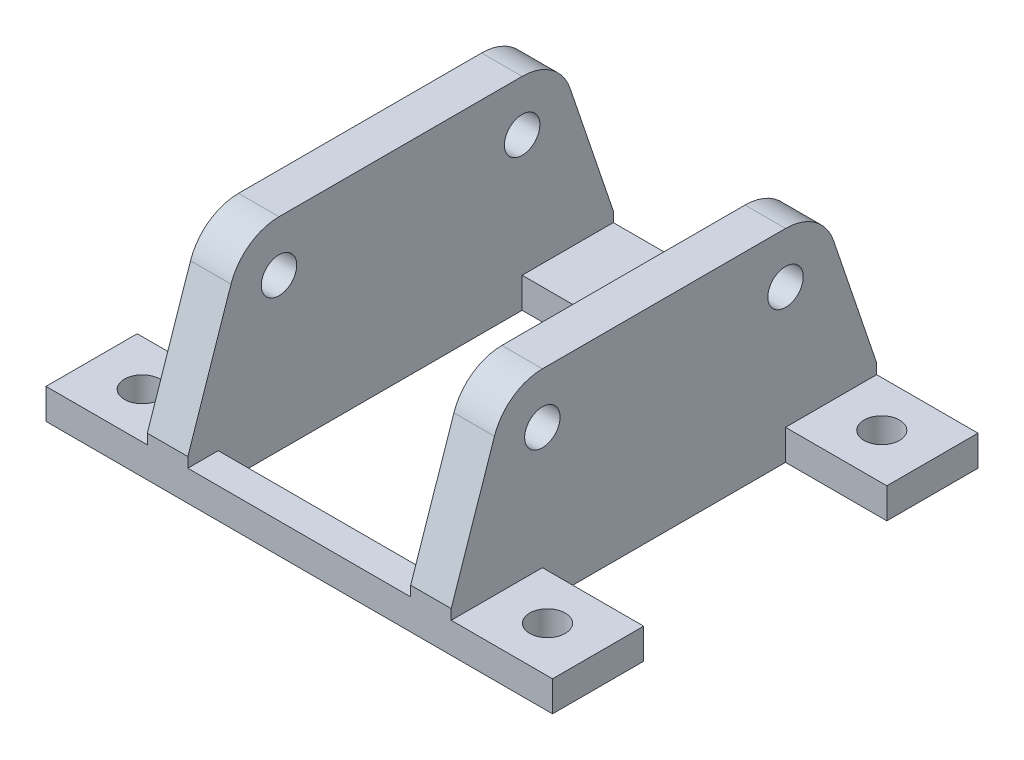
from build123d import *

# Parameters (mm, degrees)
ESBO_O1_W                  = 30
ESBO_O1_H                  = 50
ESBO_O1_W_2                = 22
ESBO_O1_H_2                = 42
RESSALTO_EXTRUS_O1_DEPTH   = 20
ESBO_O3_R                  = 1.75
CORTE_EXTRUS_O2_DEPTH      = 44.874821937
CORTE_EXTRUS_O3_DEPTH      = 44.874821937
CORTE_EXTRUS_O3_DEPTH_BACK = 44.874821937
ESBO_O6_R                  = 1.75
ESBO_O6_W                  = 50
ESBO_O6_H                  = 9
RESSALTO_EXTRUS_O2_DEPTH   = 3


with BuildPart() as part:
    # Esboço1 → Ressalto-extrusão1 (new body)
    with BuildSketch(Plane(origin=(0, 0, 0), x_dir=(1, 0, 0), z_dir=(0, 1, 0))):
        Rectangle(ESBO_O1_W, ESBO_O1_H)
        Rectangle(ESBO_O1_W_2, ESBO_O1_H_2, mode=Mode.SUBTRACT)
    extrude(amount=RESSALTO_EXTRUS_O1_DEPTH)

    # Esboço3 → Corte-extrusão2 (cut, through all)
    with BuildSketch(Plane(origin=(15, 0, 0), x_dir=(0, 0, -1), z_dir=(1, 0, 0))):
        with Locations((-12, 15)):
            Circle(ESBO_O3_R)
        with Locations((12, 15)):
            Circle(ESBO_O3_R)
    extrude(amount=-CORTE_EXTRUS_O2_DEPTH, mode=Mode.SUBTRACT)

    # Esboço5 → Corte-extrusão3 (cut, two sides: drawn at the far end of the back side and taken through both)
    with BuildSketch(Plane.ZY.offset(15).offset(-CORTE_EXTRUS_O3_DEPTH_BACK)):
        with BuildLine():
            Line((-16.736274298, 16.602406244), (-21, 4))
            Line((-21, 4), (-21, 0))
            Line((-21, 0), (-25, 0))
            Line((-25, 0), (-25, 4))
            Line((-25, 4), (-25, 20))
            Line((-25, 20), (-12, 20))
            ThreePointArc((-12, 20), (-14.914444096, 19.062759605), (-16.736274298, 16.602406244))
        make_face()
        with BuildLine():
            Line((25, 0), (25, 4))
            Line((25, 4), (25, 20))
            Line((25, 20), (12, 20))
            ThreePointArc((12, 20), (14.914444096, 19.062759605), (16.736274298, 16.602406244))
            Line((16.736274298, 16.602406244), (21, 4))
            Line((21, 4), (21, 0))
            Line((21, 0), (25, 0))
        make_face()
    extrude(amount=CORTE_EXTRUS_O3_DEPTH + CORTE_EXTRUS_O3_DEPTH_BACK, mode=Mode.SUBTRACT)


with BuildPart() as corte_extrus_o3_piece_1:
    # of the separate pieces the step leaves, piece 1, a body of its own (corte_extrus_o3_pieces)
    add(part.part.solids().sort_by_distance((-15, 0, 21))[0])



with BuildPart() as corte_extrus_o3_piece_2:
    # of the separate pieces the step leaves, piece 2, a body of its own (corte_extrus_o3_pieces)
    add(part.part.solids().sort_by_distance((15, 0, -21))[0])


with BuildPart() as corte_extrus_o3_piece_1_1:
    add(corte_extrus_o3_piece_1.part)

    add(corte_extrus_o3_piece_2.part)  # Ressalto-extrusão2 merges Corte-extrusão3 piece 2
    # Esboço6 → Ressalto-extrusão2 (add)
    # profile 1 of 2: a face of its own
    with BuildSketch(Plane.XZ):
        Polygon((-15, 21), (15, 21), (25, 21), (25, 12), (15, 12), (15, 18), (-15, 18), (-15, 12), (-25, 12), (-25, 21), align=None)
        with Locations(Location((20, 16.5, 0), (0, 0, 90))):
            Circle(ESBO_O6_R, mode=Mode.SUBTRACT)
        with Locations(Location((-20, 16.5, 0), (0, 0, 90))):
            Circle(ESBO_O6_R, mode=Mode.SUBTRACT)
    # profile 2 of 2: a face of its own
    with BuildSketch(Plane.XZ):
        with Locations((0, -16.5)):
            Rectangle(ESBO_O6_W, ESBO_O6_H)
        with Locations(Location((-20, -16.5, 0), (0, 0, 270))):
            Circle(ESBO_O6_R, mode=Mode.SUBTRACT)
        with Locations(Location((20, -16.5, 0), (0, 0, 270))):
            Circle(ESBO_O6_R, mode=Mode.SUBTRACT)
    extrude(amount=-RESSALTO_EXTRUS_O2_DEPTH)


solid = corte_extrus_o3_piece_1_1.part
